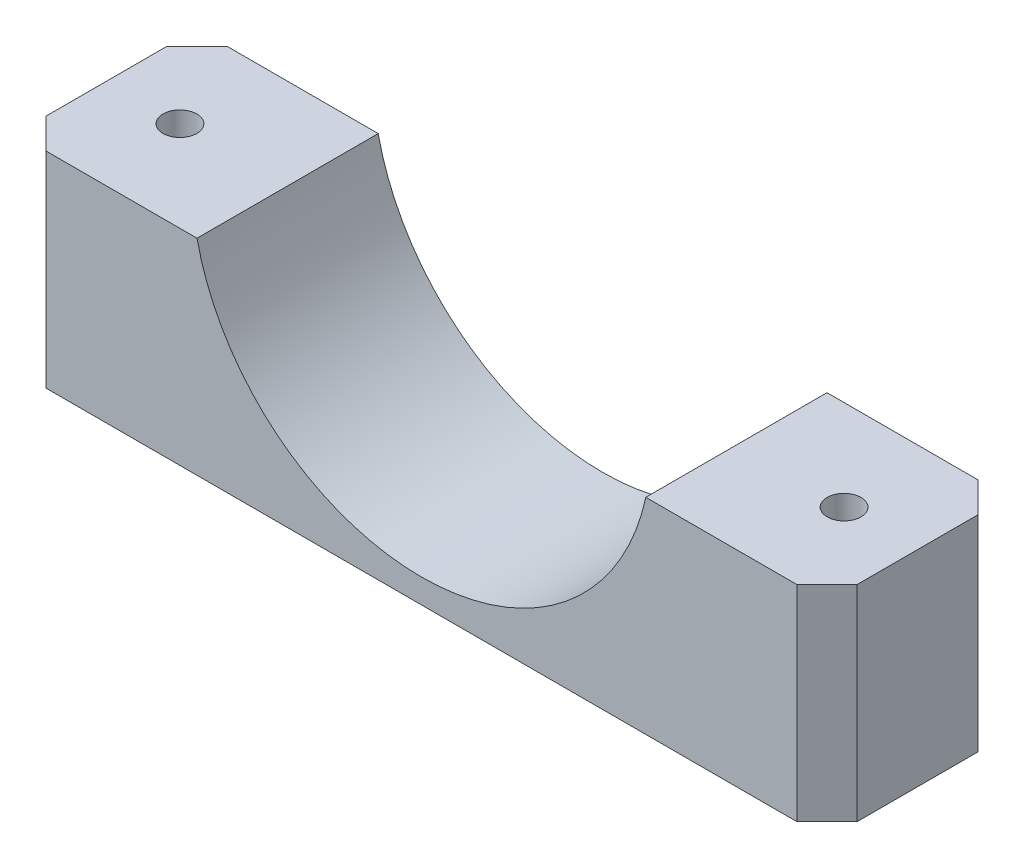
from build123d import *

# Parameters (mm, degrees)
BOSS_EXTRUDE1_DEPTH = 15
CHAMFER1_SIZE       = 2.5
SKETCH2_R           = 1.4
CUT_EXTRUDE1_DEPTH  = 41.512038564


with BuildPart() as part:
    # Sketch1 → Boss-Extrude1 (new body)
    with BuildSketch(Plane.XY):
        with BuildLine():
            Line((-18.574175621, -4), (-33.574175621, -4))
            Line((-33.574175621, -4), (-33.574175621, -21))
            Line((-33.574175621, -21), (33.574175621, -21))
            Line((33.574175621, -21), (33.574175621, -4))
            Line((33.574175621, -4), (18.574175621, -4))
            ThreePointArc((18.574175621, -4), (0, -19), (-18.574175621, -4))
        make_face()
    extrude(amount=BOSS_EXTRUDE1_DEPTH)

    # Chamfer1
    chamfer1_edges = [part.edges().sort_by_distance(p)[0] for p in [
        (-33.574175621, -12.5, 15),
        (33.574175621, -12.5, 15),
        (-33.574175621, -12.5, 0),
        (33.574175621, -12.5, 0),
    ]]
    chamfer(chamfer1_edges, length=CHAMFER1_SIZE)

    # Sketch2 → Cut-Extrude1 (cut, through all)
    with BuildSketch(Plane(origin=(0, -4, 0), x_dir=(1, 0, 0), z_dir=(0, 1, 0))):
        with Locations(Location((27.488644481, -7.5, 0), (0, 0, 180))):
            Circle(SKETCH2_R)
        with Locations((-27.488644481, -7.5)):
            Circle(SKETCH2_R)
    extrude(amount=-CUT_EXTRUDE1_DEPTH, mode=Mode.SUBTRACT)


solid = part.part
